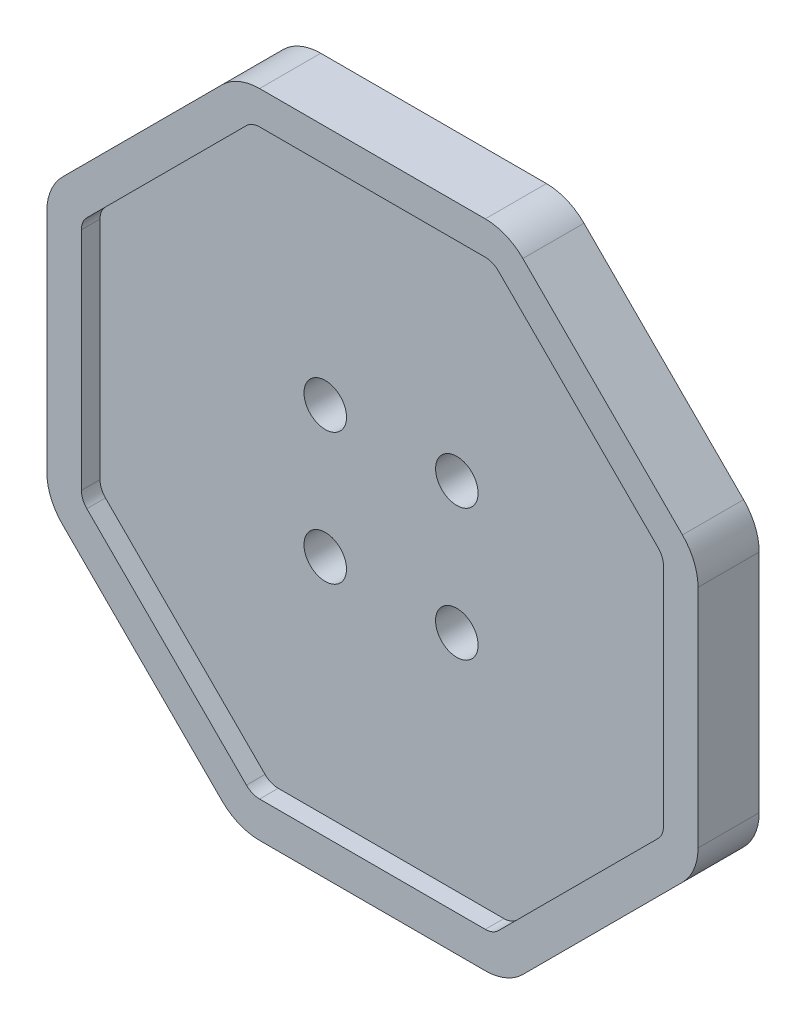
from build123d import *

# Parameters (mm, degrees)
SKETCH1_R           = 1.6
BOSS_EXTRUDE1_DEPTH = 4.6
CUT_EXTRUDE2_DEPTH  = 1.4


with BuildPart() as part:
    # Sketch1 → Boss-Extrude1 (new body)
    with BuildSketch(Plane.XY):
        with BuildLine():
            Line((-11.319805153, 23.328427125), (-23.328427125, 11.319805153))
            ThreePointArc((-23.328427125, 11.319805153), (-24.19551813, 10.022111758), (-24.5, 8.491378029))
            Line((-24.5, 8.491378029), (-24.5, -8.491378029))
            ThreePointArc((-24.5, -8.491378029), (-24.19551813, -10.022111758), (-23.328427125, -11.319805153))
            Line((-23.328427125, -11.319805153), (-11.319805153, -23.328427125))
            ThreePointArc((-11.319805153, -23.328427125), (-10.022111758, -24.19551813), (-8.491378029, -24.5))
            Line((-8.491378029, -24.5), (8.491378029, -24.5))
            ThreePointArc((8.491378029, -24.5), (10.022111758, -24.19551813), (11.319805153, -23.328427125))
            Line((11.319805153, -23.328427125), (23.328427125, -11.319805153))
            ThreePointArc((23.328427125, -11.319805153), (24.19551813, -10.022111758), (24.5, -8.491378029))
            Line((24.5, -8.491378029), (24.5, 8.491378029))
            ThreePointArc((24.5, 8.491378029), (24.19551813, 10.022111758), (23.328427125, 11.319805153))
            Line((23.328427125, 11.319805153), (11.319805153, 23.328427125))
            ThreePointArc((11.319805153, 23.328427125), (10.022111758, 24.19551813), (8.491378029, 24.5))
            Line((8.491378029, 24.5), (-8.491378029, 24.5))
            ThreePointArc((-8.491378029, 24.5), (-10.022111758, 24.19551813), (-11.319805153, 23.328427125))
        make_face()
        with Locations((-4.949747468, 4.949747468)):
            Circle(SKETCH1_R, mode=Mode.SUBTRACT)
        with Locations((4.949747468, 4.949747468)):
            Circle(SKETCH1_R, mode=Mode.SUBTRACT)
        with Locations((4.949747468, -4.949747468)):
            Circle(SKETCH1_R, mode=Mode.SUBTRACT)
        with Locations((-4.949747468, -4.949747468)):
            Circle(SKETCH1_R, mode=Mode.SUBTRACT)
    extrude(amount=BOSS_EXTRUDE1_DEPTH)

    # Sketch3 → Cut-Extrude2 (cut)
    with BuildSketch(Plane.XY.offset(4.6)):
        with BuildLine():
            Line((8.491378029, 22), (-8.491378029, 22))
            ThreePointArc((-8.491378029, 22), (-9.027134834, 21.893431346), (-9.481327522, 21.589949494))
            Line((-9.481327522, 21.589949494), (-21.489949494, 9.581327522))
            ThreePointArc((-21.489949494, 9.581327522), (-21.793431346, 9.127134834), (-21.9, 8.591378029))
            Line((-21.9, 8.591378029), (-21.9, -8.391378029))
            ThreePointArc((-21.9, -8.391378029), (-21.793431346, -8.927134834), (-21.489949494, -9.381327522))
            Line((-21.489949494, -9.381327522), (-9.481327522, -21.389949494))
            ThreePointArc((-9.481327522, -21.389949494), (-9.027134834, -21.693431346), (-8.491378029, -21.8))
            Line((-8.491378029, -21.8), (8.491378029, -21.8))
            ThreePointArc((8.491378029, -21.8), (9.027134834, -21.693431346), (9.481327522, -21.389949494))
            Line((9.481327522, -21.389949494), (21.489949494, -9.381327522))
            ThreePointArc((21.489949494, -9.381327522), (21.793431346, -8.927134834), (21.9, -8.391378029))
            Line((21.9, -8.391378029), (21.9, 8.591378029))
            ThreePointArc((21.9, 8.591378029), (21.793431346, 9.127134834), (21.489949494, 9.581327522))
            Line((21.489949494, 9.581327522), (9.481327522, 21.589949494))
            ThreePointArc((9.481327522, 21.589949494), (9.027134834, 21.893431346), (8.491378029, 22))
        make_face()
    extrude(amount=-CUT_EXTRUDE2_DEPTH, mode=Mode.SUBTRACT)


solid = part.part
